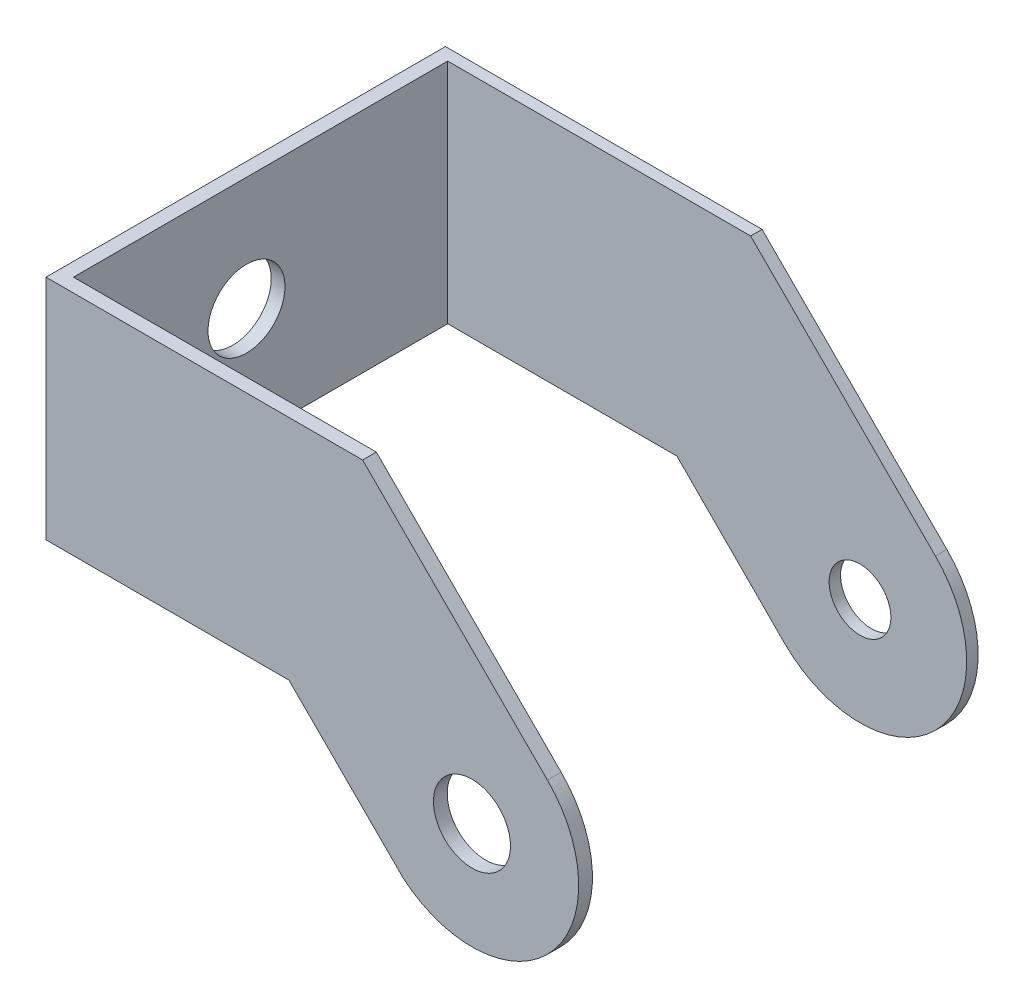
from build123d import *

# Parameters (mm, degrees)
ESBO_O1_R                = 5.05
RESSALTO_EXTRUS_O2_DEPTH = 1.8
ESBO_O2_W                = 49.1
ESBO_O2_H                = 29.842997711
ESBO_O2_R                = 5.05
RESSALTO_EXTRUS_O3_DEPTH = 1.8
RESSALTO_EXTRUS_O5_START = 1.5
ESBO_O3_R                = 4.05
RESSALTO_EXTRUS_O5_DEPTH = 1.5


with BuildPart() as part:
    # Esboço1 → Ressalto-extrusão2 (new body)
    with BuildSketch(Plane.XY):
        with BuildLine():
            Line((9.899494937, 9.899494937), (-14.345555324, 34.144545197))
            Line((-14.345555324, 34.144545197), (-55.882327004, 34.144545197))
            Line((-55.882327004, 34.144545197), (-55.882327004, 4.301547486))
            Line((-55.882327004, 4.301547486), (-24.020751859, 4.301547486))
            Line((-24.020751859, 4.301547486), (-8.97177071, -10.747433663))
            ThreePointArc((-8.97177071, -10.747433663), (10.333880356, -9.445153085), (9.899494937, 9.899494937))
        make_face()
        Circle(ESBO_O1_R, mode=Mode.SUBTRACT)
    extrude(amount=RESSALTO_EXTRUS_O2_DEPTH)

    # Esboço2 → Ressalto-extrusão3 (add)
    with BuildSketch(Plane(origin=(-55.882327004, 0, 0), x_dir=(0, 0, -1), z_dir=(1, 0, 0))):
        with Locations((24.55, 19.223046342)):
            Rectangle(ESBO_O2_W, ESBO_O2_H)
        with Locations((22.7, 19.213463732)):
            Circle(ESBO_O2_R, mode=Mode.SUBTRACT)
    extrude(amount=RESSALTO_EXTRUS_O3_DEPTH)

    # Esboço3 → Ressalto-extrusão5 (add)
    with BuildSketch(Plane(origin=(0, 0, -49.1), x_dir=(-1, 0, 0), z_dir=(0, 0, -1)).offset(RESSALTO_EXTRUS_O5_START)):
        with BuildLine():
            Line((-9.899494937, 9.899494937), (14.345555324, 34.144545197))
            Line((14.345555324, 34.144545197), (55.882327004, 34.144545197))
            Line((55.882327004, 34.144545197), (55.882327004, 4.301547486))
            Line((55.882327004, 4.301547486), (24.020751859, 4.301547486))
            Line((24.020751859, 4.301547486), (9.899494937, -9.899494937))
            ThreePointArc((9.899494937, -9.899494937), (-9.899494937, -9.899494937), (-9.899494937, 9.899494937))
        make_face()
        Circle(ESBO_O3_R, mode=Mode.SUBTRACT)
    extrude(amount=-RESSALTO_EXTRUS_O5_DEPTH)


solid = part.part
